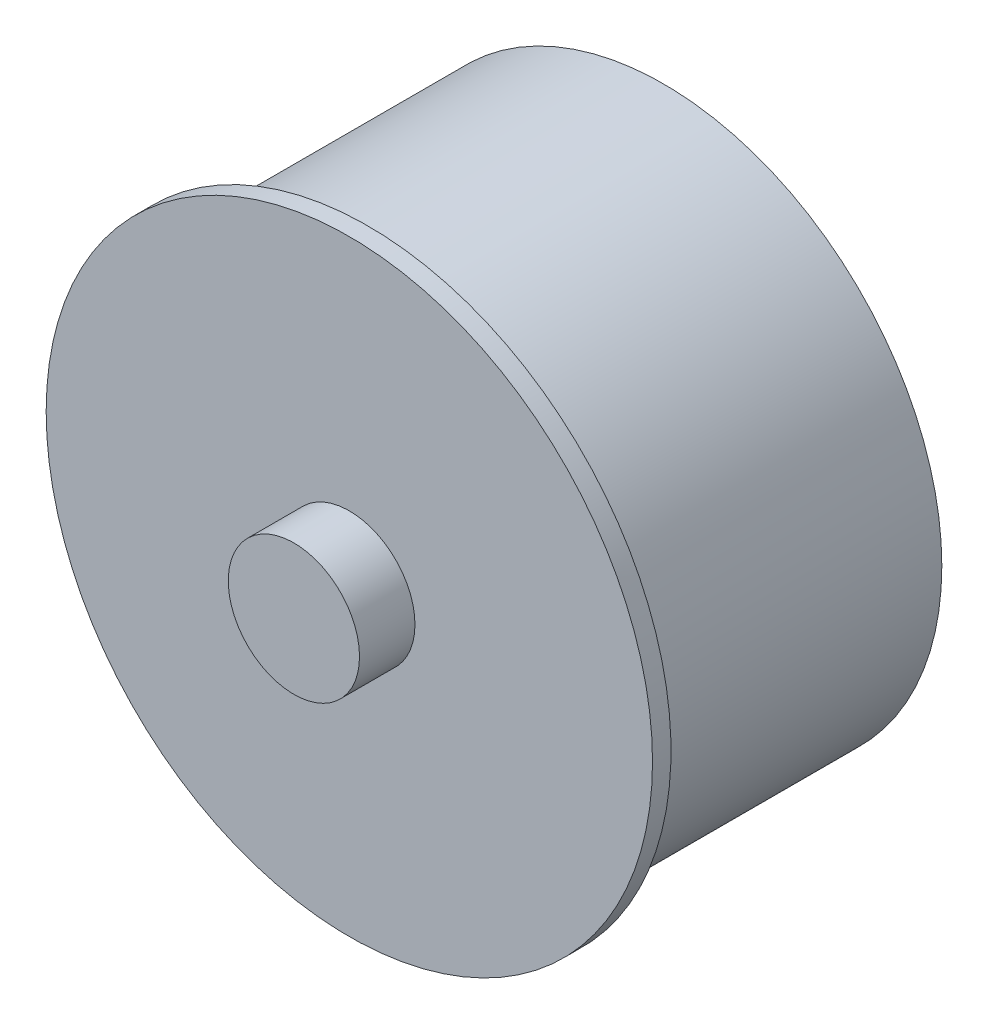
from build123d import *

# Parameters (mm, degrees)
SKETCH_1_R          = 16.4
EXTRUDE_1_DEPTH     = 17
SKETCH_2_R          = 3.55
EXTRUDE_2_DEPTH     = 3
SKETCH_3_R          = 10.075
EXTRUDE_3_DEPTH     = 2
SKETCH_7_R          = 1.05
CUT_EXTRUDE_3_DEPTH = 10
SKETCH3_R           = 16.4
SKETCH3_R_2         = 15.05
CUT_EXTRUDE3_DEPTH  = 16


with BuildPart() as part:
    # 草图1 → 凸台-拉伸1 (new body)
    with BuildSketch(Plane.XY):
        Circle(SKETCH_1_R)
    extrude(amount=EXTRUDE_1_DEPTH)

    # 草图2 → 凸台-拉伸2 (add)
    with BuildSketch(Plane.XY.offset(17)):
        Circle(SKETCH_2_R)
    extrude(amount=EXTRUDE_2_DEPTH)


with BuildPart() as body_2:
    # 草图3 → 凸台-拉伸3 (new body)
    with BuildSketch(Plane(origin=(0, 0, 0), x_dir=(-1, 0, 0), z_dir=(0, 0, -1))):
        Circle(SKETCH_3_R)
    extrude(amount=EXTRUDE_3_DEPTH)


with BuildPart() as cut_extrude_3_tool:
    # 草图7 → 切除-拉伸3 (new body)
    with BuildSketch(Plane(origin=(0, 0, -2), x_dir=(-1, 0, 0), z_dir=(0, 0, -1))):
        with Locations((0, 8)):
            Circle(SKETCH_7_R)
        with Locations((8, 0)):
            Circle(SKETCH_7_R)
        with Locations((0, -8)):
            Circle(SKETCH_7_R)
        with Locations((-8, 0)):
            Circle(SKETCH_7_R)
    extrude(amount=-CUT_EXTRUDE_3_DEPTH)


with BuildPart() as part_1:
    add(part.part)

    # 切除-拉伸3: cut by cut_extrude_3_tool
    add(cut_extrude_3_tool.part, mode=Mode.SUBTRACT)

    # Sketch3 → Cut-Extrude3 (cut)
    with BuildSketch(Plane(origin=(0, 0, 0), x_dir=(-1, 0, 0), z_dir=(0, 0, -1))):
        Circle(SKETCH3_R)
        Circle(SKETCH3_R_2, mode=Mode.SUBTRACT)
    extrude(amount=-CUT_EXTRUDE3_DEPTH, mode=Mode.SUBTRACT)


with BuildPart() as body_2_1:
    add(body_2.part)

    # 切除-拉伸3: cut by cut_extrude_3_tool
    add(cut_extrude_3_tool.part, mode=Mode.SUBTRACT)


solid = Compound([part_1.part, body_2_1.part])
